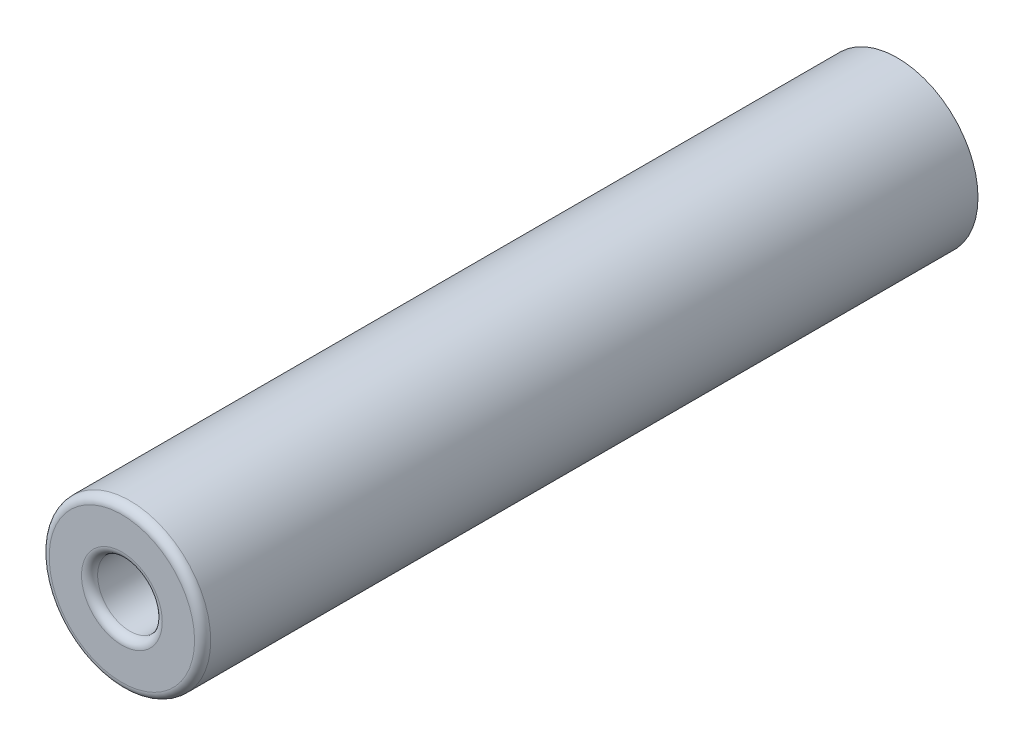
from build123d import *

# Parameters (mm, degrees)
CROQUIS1_R              = 2.5
SALIENTE_EXTRUIR1_DEPTH = 24
CROQUIS2_R              = 1
CORTAR_EXTRUIR1_DEPTH   = 10
REDONDEO1_R             = 0.25


with BuildPart() as part:
    # Croquis1 → Saliente-Extruir1 (new body)
    with BuildSketch(Plane.XY):
        Circle(CROQUIS1_R)
    extrude(amount=SALIENTE_EXTRUIR1_DEPTH)

    # Croquis2 → Cortar-Extruir1 (cut)
    with BuildSketch(Plane.XY.offset(24)):
        Circle(CROQUIS2_R)
    extrude(amount=-CORTAR_EXTRUIR1_DEPTH, mode=Mode.SUBTRACT)

    # Redondeo1
    redondeo1_edges = [part.edges().sort_by_distance(p)[0] for p in [
        (-2.5, 0, 24),
        (-1, 0, 24),
    ]]
    fillet(redondeo1_edges, radius=REDONDEO1_R)


solid = part.part
